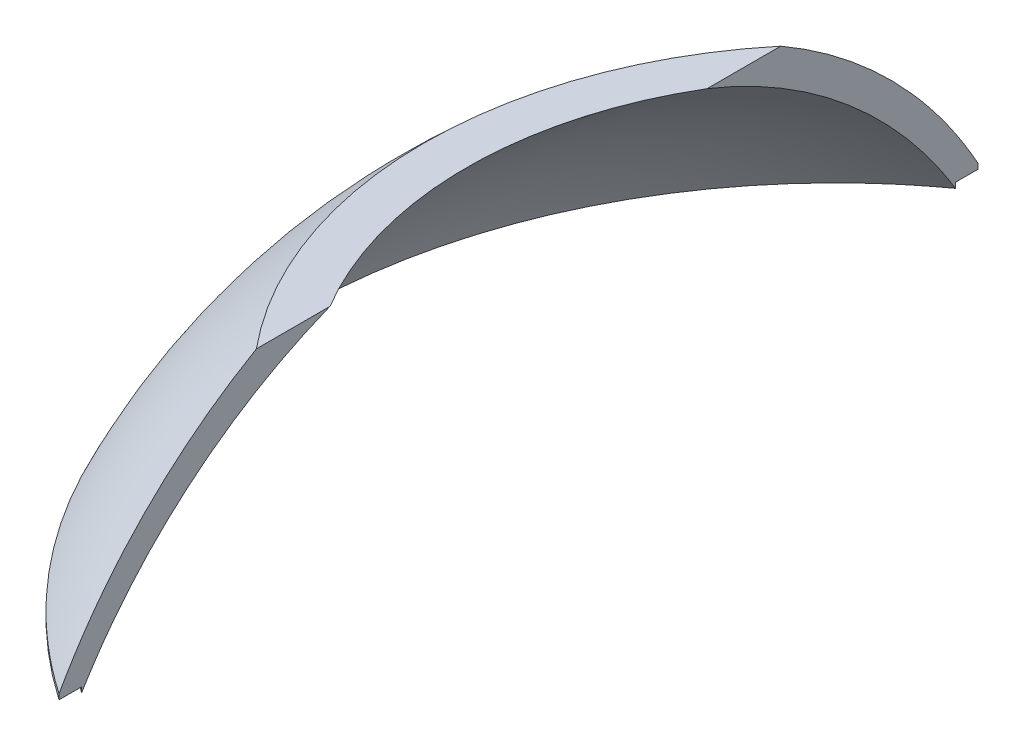
from build123d import *

# Parameters (mm, degrees)
SKETCH1_R           = 106
BOSS_EXTRUDE1_DEPTH = 1
DOME1_FACE_RADIUS   = 106
DOME1_HEIGHT        = 68
SKETCH3_R           = 102.5
BOSS_EXTRUDE2_DEPTH = 1
DOME3_FACE_RADIUS   = 102.5
DOME3_HEIGHT        = 64
SKETCH4_R           = 141.495239339
CUT_EXTRUDE1_DEPTH  = 30
SKETCH6_W           = 177.061938601
SKETCH6_H           = 266.714694693
CUT_EXTRUDE3_DEPTH  = 61


with BuildPart() as part:
    # Sketch1 → Boss-Extrude1 (new body)
    with BuildSketch(Plane(origin=(0, 0, 0), x_dir=(1, 0, 0), z_dir=(0, 1, 0))):
        with Locations(Location((0, 0, 0), (0, 0, 270))):
            Circle(SKETCH1_R)
    extrude(amount=BOSS_EXTRUDE1_DEPTH)

    # Dome1: a dome of height H over a round flat face of radius A is a cap of a sphere of radius (A * A + H * H) / (2 * H)
    dome1_r = (DOME1_FACE_RADIUS * DOME1_FACE_RADIUS + DOME1_HEIGHT * DOME1_HEIGHT) / (2 * DOME1_HEIGHT)
    dome1_base = Plane((0, 1, 0), z_dir=(0, 1, 0))
    with Locations(dome1_base.offset(DOME1_HEIGHT - dome1_r)):
        dome1_ball = Sphere(dome1_r, mode=Mode.PRIVATE)
    add(split(dome1_ball, bisect_by=dome1_base, keep=Keep.TOP, mode=Mode.PRIVATE))

    # Sketch3 → Boss-Extrude2 (add)
    with BuildSketch(Plane.XZ):
        with Locations(Location((0, 0, 0), (0, 0, 270))):
            Circle(SKETCH3_R)
    extrude(amount=BOSS_EXTRUDE2_DEPTH)

    # Dome3: a dome of height H over a round flat face of radius A is a cap of a sphere of radius (A * A + H * H) / (2 * H)
    dome3_r = (DOME3_FACE_RADIUS * DOME3_FACE_RADIUS + DOME3_HEIGHT * DOME3_HEIGHT) / (2 * DOME3_HEIGHT)
    dome3_base = Plane((0, -1, 0), z_dir=(0, 1, 0))
    with Locations(dome3_base.offset(DOME3_HEIGHT - dome3_r)):
        dome3_ball = Sphere(dome3_r, mode=Mode.PRIVATE)
    add(split(dome3_ball, bisect_by=dome3_base, keep=Keep.TOP, mode=Mode.PRIVATE), mode=Mode.SUBTRACT)

    # Sketch4 → Cut-Extrude1 (cut)
    with BuildSketch(Plane(origin=(0, 69, 0), x_dir=(1, 0, 0), z_dir=(0, 1, 0))):
        Circle(SKETCH4_R)
    extrude(amount=-CUT_EXTRUDE1_DEPTH, mode=Mode.SUBTRACT)

    # Sketch6 → Cut-Extrude3 (cut)
    with BuildSketch(Plane(origin=(0, 39, 0), x_dir=(1, 0, 0), z_dir=(0, 1, 0))):
        with Locations((28.391818017, 2.178811005)):
            Rectangle(SKETCH6_W, SKETCH6_H)
    extrude(amount=-CUT_EXTRUDE3_DEPTH, mode=Mode.SUBTRACT)


solid = part.part
